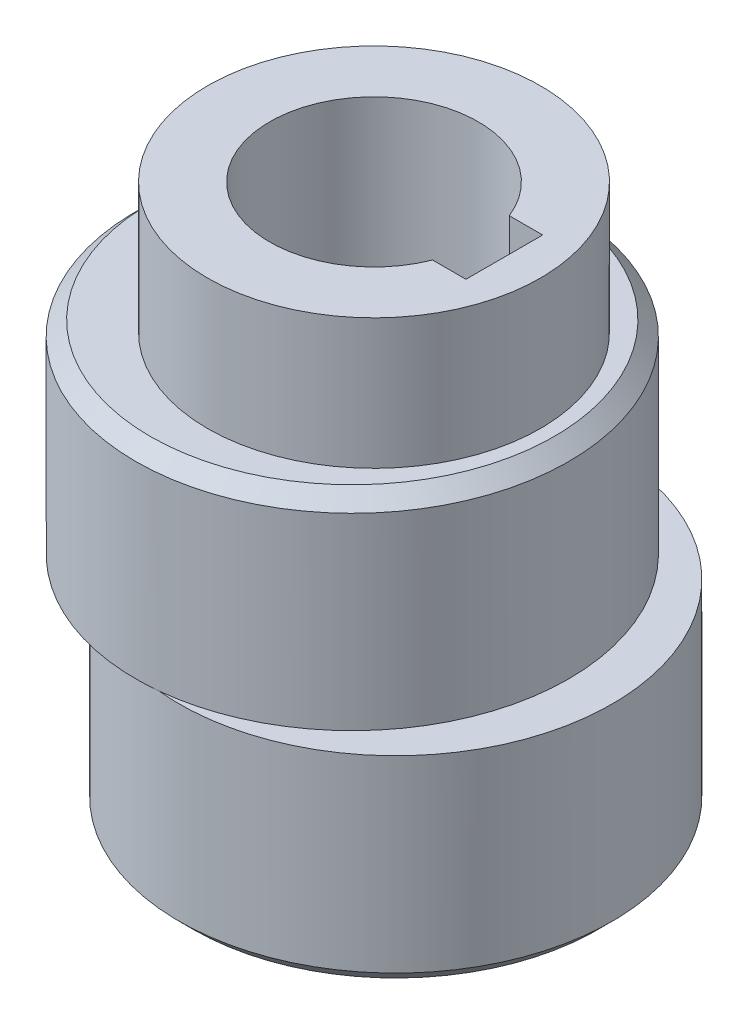
from build123d import *

# Parameters (mm, degrees)
SKETCH1_R               = 14.95
BOSS_EXTRUDE1_DEPTH     = 14
SKETCH3_R               = 14.95
BOSS_EXTRUDE2_DEPTH     = 14
CHAMFER1_SIZE           = 1
SKETCH11_R              = 11.5
BOSS_EXTRUDE3_DEPTH     = 9
CUT_EXTRUDE1_DEPTH      = 37.465120321
CUT_EXTRUDE1_DEPTH_BACK = 37.465120321
SKETCH9_R               = 7.2
CUT_EXTRUDE2_DEPTH      = 37.465120321
CUT_EXTRUDE2_DEPTH_BACK = 37.465120321
SKETCH10_W              = 2.718236021
SKETCH10_H              = 5.3


with BuildPart() as part:
    # Sketch1 → Boss-Extrude1 (new body)
    with BuildSketch(Plane(origin=(0, 0, 0), x_dir=(1, 0, 0), z_dir=(0, 1, 0))):
        with Locations(Location((0, 0, 0), (0, 0, 270))):
            Circle(SKETCH1_R)
    extrude(amount=BOSS_EXTRUDE1_DEPTH)

    # Sketch3 → Boss-Extrude2 (add)
    with BuildSketch(Plane.XZ):
        with Locations(Location((3, 0, 0), (0, 0, 95.758429808))):
            Circle(SKETCH3_R)
    extrude(amount=BOSS_EXTRUDE2_DEPTH)

    # Chamfer1
    chamfer1_edges = [part.edges().sort_by_distance(p)[0] for p in [
        (0, 14, -14.95),
        (4.5, -14, -14.874558817),
    ]]
    chamfer(chamfer1_edges, length=CHAMFER1_SIZE)

    # Sketch11 → Boss-Extrude3 (add)
    with BuildSketch(Plane(origin=(0, 14, 0), x_dir=(1, 0, 0), z_dir=(0, 1, 0))):
        with Locations(Location((1.5, 0, 0), (0, 0, 270))):
            Circle(SKETCH11_R)
    extrude(amount=BOSS_EXTRUDE3_DEPTH)

    # Sketch9 → Cut-Extrude1 (cut, two sides: drawn at the far end of the back side and taken through both)
    with BuildSketch(Plane(origin=(0, 14, 0), x_dir=(1, 0, 0), z_dir=(0, 1, 0)).offset(-CUT_EXTRUDE1_DEPTH_BACK)):
        with Locations(Location((1.5, 0, 0), (0, 0, 270))):
            Circle(SKETCH9_R)
    extrude(amount=CUT_EXTRUDE1_DEPTH + CUT_EXTRUDE1_DEPTH_BACK, mode=Mode.SUBTRACT)

    # Sketch10 → Cut-Extrude2 (cut, two sides: drawn at the far end of the back side and taken through both)
    with BuildSketch(Plane(origin=(0, 14, 0), x_dir=(1, 0, 0), z_dir=(0, 1, 0)).offset(-CUT_EXTRUDE2_DEPTH_BACK)):
        with Locations((9.14088199, 0)):
            Rectangle(SKETCH10_W, SKETCH10_H)
    extrude(amount=CUT_EXTRUDE2_DEPTH + CUT_EXTRUDE2_DEPTH_BACK, mode=Mode.SUBTRACT)


solid = part.part
